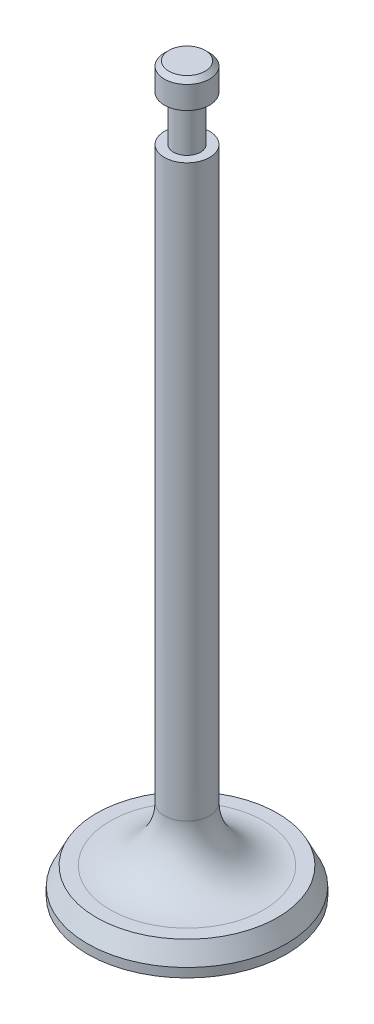
from build123d import *

# Parameters (mm, degrees)
FILLET1_R      = 6
CHAMFER1_SIZE  = 1
CHAMFER1_SIZE2 = 2
CHAMFER2_SIZE  = 0.5


with BuildPart() as part:
    # Sketch1 → Revolve1 (revolve)
    with BuildSketch(Plane(origin=(0, 0, 0), x_dir=(0, 0, -1), z_dir=(1, 0, 0))):
        Polygon((0, 0), (0, -80), (11, -80), (11, -77), (2.5, -77), (2.5, -8), (1.5, -8), (1.5, -3), (2.5, -3), (2.5, 0), align=None)
    revolve(axis=Axis((0, 0, 0), (0, -1, 0)))

    # Fillet1
    fillet1_edges = [part.edges().sort_by_distance(p)[0] for p in [
        (0, -77, 2.5),
    ]]
    fillet(fillet1_edges, radius=FILLET1_R)

    # Chamfer1
    chamfer1_edges = [part.edges().sort_by_distance(p)[0] for p in [
        (0, -77, 11),
    ]]
    chamfer1_side = [part.faces().sort_by_distance(p)[0] for p in [
        (0, -77, 8.811126984),
    ]]
    chamfer(chamfer1_edges, length=CHAMFER1_SIZE, length2=CHAMFER1_SIZE2, reference=chamfer1_side[0])

    # Chamfer2
    chamfer2_edges = [part.edges().sort_by_distance(p)[0] for p in [
        (0, 0, 2.5),
    ]]
    chamfer(chamfer2_edges, length=CHAMFER2_SIZE)


solid = part.part
